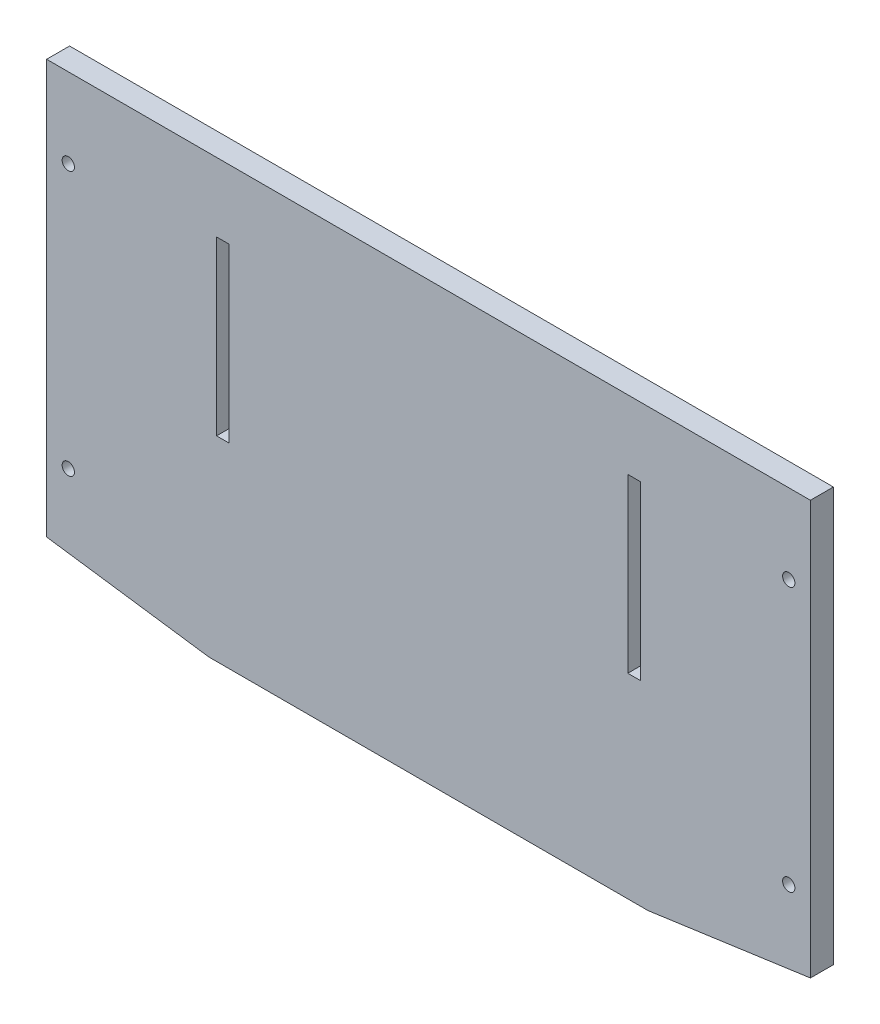
from build123d import *

# Parameters (mm, degrees)
SKETCH1_W            = 211.1756
SKETCH1_H            = 127
BOSS_EXTRUDE1_DEPTH  = 6.35
M3_CLEARANCE_HOLE1_D = 3.4
SKETCH4_W            = 3.5052
SKETCH4_H            = 47.625
CUT_EXTRUDE1_DEPTH   = 247.50447569
CUT_EXTRUDE2_DEPTH   = 247.50447569
SKETCH6_W            = 121.4628
SKETCH6_H            = 6.35
CUT_EXTRUDE3_DEPTH   = 247.50447569


with BuildPart() as part:
    # Sketch1 → Boss-Extrude1 (new body)
    with BuildSketch(Plane.XY):
        with Locations((105.5878, 63.5)):
            Rectangle(SKETCH1_W, SKETCH1_H)
    extrude(amount=BOSS_EXTRUDE1_DEPTH)

    # M3 Clearance Hole1 (through all)
    with Locations(Plane.XY.offset(6.35)):
        with Locations((5.9944, 105.0036), (5.9944, 31.9786), (205.1812, 31.9786), (205.1812, 105.0036)):
            Hole(M3_CLEARANCE_HOLE1_D / 2)

    # Sketch4 → Cut-Extrude1 (cut, through all)
    with BuildSketch(Plane.XY.offset(6.35)):
        with Locations((48.7426, 84.1375)):
            Rectangle(SKETCH4_W, SKETCH4_H)
        with Locations((162.433, 84.1375)):
            Rectangle(SKETCH4_W, SKETCH4_H)
    extrude(amount=-CUT_EXTRUDE1_DEPTH, mode=Mode.SUBTRACT)

    # Sketch5 → Cut-Extrude2 (cut, through all)
    with BuildSketch(Plane.XY.offset(6.35)):
        Polygon((0, 12.608311795), (89.7128, 0), (0, 0), align=None)
        Polygon((121.4628, 0), (211.1756, 0), (211.1756, 12.608311795), align=None)
    extrude(amount=-CUT_EXTRUDE2_DEPTH, mode=Mode.SUBTRACT)

    # Sketch6 → Cut-Extrude3 (cut, through all)
    with BuildSketch(Plane.XY.offset(6.35)):
        with Locations((105.5878, 3.129155898)):
            Rectangle(SKETCH6_W, SKETCH6_H)
    extrude(amount=-CUT_EXTRUDE3_DEPTH, mode=Mode.SUBTRACT)


solid = part.part
